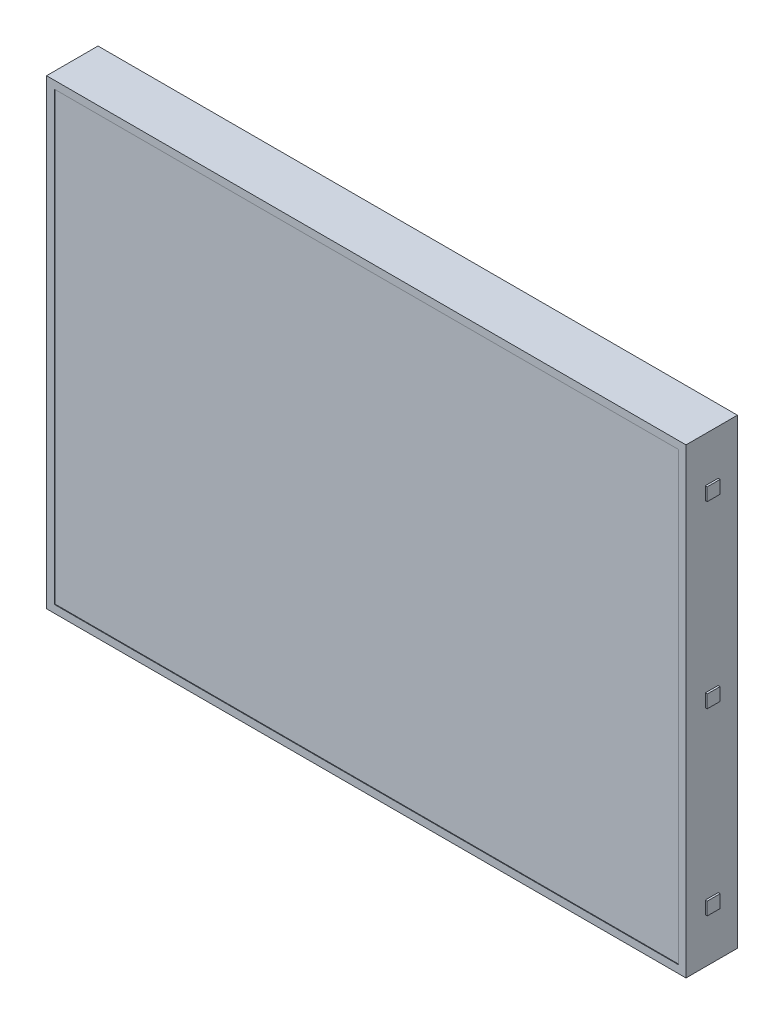
from build123d import *

# Parameters (mm, degrees)
SKETCH1_W           = 248.6
SKETCH1_H           = 179.5
BOSS_EXTRUDE1_DEPTH = 20
SKETCH2_W           = 242.6
SKETCH2_H           = 173.5
CUT_EXTRUDE1_DEPTH  = 0.25
SKETCH3_W           = 5
SKETCH3_H           = 5
BOSS_EXTRUDE2_DEPTH = 0.75
SKETCH4_R           = 2.75
CUT_EXTRUDE2_DEPTH  = 9
SKETCH6_R           = 1.05
BOSS_EXTRUDE3_DEPTH = 6
FILLET1_R           = 0.25


with BuildPart() as part:
    # Sketch1 → Boss-Extrude1 (new body)
    with BuildSketch(Plane.XY):
        Rectangle(SKETCH1_W, SKETCH1_H)
    extrude(amount=BOSS_EXTRUDE1_DEPTH)

    # Sketch2 → Cut-Extrude1 (cut)
    with BuildSketch(Plane.XY.offset(20)):
        Rectangle(SKETCH2_W, SKETCH2_H)
    extrude(amount=-CUT_EXTRUDE1_DEPTH, mode=Mode.SUBTRACT)

    # Sketch3 → Boss-Extrude2 (add)
    with BuildSketch(Plane(origin=(124.3, 0, 0), x_dir=(0, 0, -1), z_dir=(1, 0, 0))):
        with Locations((-10, 69.75)):
            Rectangle(SKETCH3_W, SKETCH3_H)
        with Locations((-10, 0)):
            Rectangle(SKETCH3_W, SKETCH3_H)
        with Locations((-10, -69.75)):
            Rectangle(SKETCH3_W, SKETCH3_H)
    extrude(amount=BOSS_EXTRUDE2_DEPTH)

    # Sketch4 → Cut-Extrude2 (cut)
    with BuildSketch(Plane.ZY.offset(124.3)):
        with Locations(Location((10, 81.631746132, 0), (0, 0, 270))):
            Circle(SKETCH4_R)
    extrude(amount=-CUT_EXTRUDE2_DEPTH, mode=Mode.SUBTRACT)

    # Sketch6 → Boss-Extrude3 (add)
    with BuildSketch(Plane.ZY.offset(115.3)):
        with Locations(Location((10, 81.631746132, 0), (0, 0, 270))):
            Circle(SKETCH6_R)
    extrude(amount=BOSS_EXTRUDE3_DEPTH)

    # Fillet1
    fillet1_edges = [part.edges().sort_by_distance(p)[0] for p in [
        (-121.3, 82.681746132, 10),
    ]]
    fillet(fillet1_edges, radius=FILLET1_R)


solid = part.part
